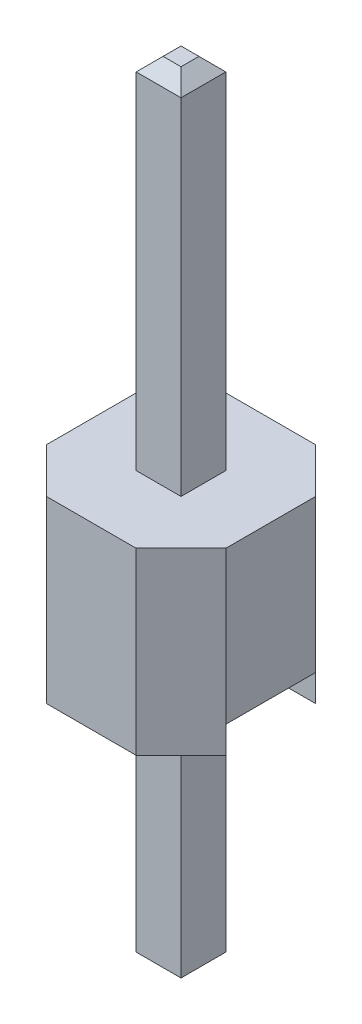
from build123d import *

# Parameters (mm, degrees)
BOSS_EXTRUDE1_DEPTH = 2.54
CUT_EXTRUDE1_REACH  = 5.81
SKETCH2_W           = 1.27
SKETCH2_H           = 0.381
SKETCH3_W           = 0.635
SKETCH3_H           = 0.635
BOSS_EXTRUDE2_DEPTH = 5.08
CHAMFER1_SIZE       = 0.1905
SKETCH4_W           = 0.635
SKETCH4_H           = 0.635
BOSS_EXTRUDE3_DEPTH = 3.937
CHAMFER2_SIZE       = 0.1905


with BuildPart() as part:
    # Sketch1 → Boss-Extrude1 (new body)
    with BuildSketch(Plane(origin=(0, 0, 0), x_dir=(1, 0, 0), z_dir=(0, 1, 0))):
        Polygon((0.635, 1.27), (1.27, 0.635), (1.27, -0.635), (0.635, -1.27), (-0.635, -1.27), (-1.27, -0.635), (-1.27, 0.635), (-0.635, 1.27), align=None)
    extrude(amount=BOSS_EXTRUDE1_DEPTH)

    # Cut-Extrude1: up to this face of the body (flat: up to its plane)
    cut_extrude1_end = Plane(part.part.faces().sort_by_distance((-1.27, 1.27, 0))[0])
    # Sketch2 → Cut-Extrude1 (cut, up to the picked face)
    with BuildSketch(Plane(origin=(1.27, 0, 0), x_dir=(0, 0, -1), z_dir=(1, 0, 0)), mode=Mode.PRIVATE) as cut_extrude1_sk1:
        with Locations((0, 0.1905)):
            Rectangle(SKETCH2_W, SKETCH2_H)
    cut_extrude1_tool1 = split(extrude(cut_extrude1_sk1.sketch, amount=-CUT_EXTRUDE1_REACH, mode=Mode.PRIVATE), bisect_by=cut_extrude1_end, keep=Keep.BOTH, mode=Mode.PRIVATE)
    add(cut_extrude1_tool1.solids().sort_by(Axis((1.27, 0.1905, 0), (-1, 0, 0)))[0], mode=Mode.SUBTRACT)

    # Sketch3 → Boss-Extrude2 (add)
    with BuildSketch(Plane(origin=(0, 2.54, 0), x_dir=(1, 0, 0), z_dir=(0, 1, 0))):
        Rectangle(SKETCH3_W, SKETCH3_H)
    extrude(amount=BOSS_EXTRUDE2_DEPTH)

    # Chamfer1
    chamfer1_edges = [part.edges().sort_by_distance(p)[0] for p in [
        (0.3175, 7.62, 0),
        (0, 7.62, -0.3175),
        (-0.3175, 7.62, 0),
        (0, 7.62, 0.3175),
    ]]
    chamfer(chamfer1_edges, length=CHAMFER1_SIZE)

    # Sketch4 → Boss-Extrude3 (add)
    with BuildSketch(Plane.XZ.offset(-0.381)):
        Rectangle(SKETCH4_W, SKETCH4_H)
    extrude(amount=BOSS_EXTRUDE3_DEPTH)

    # Chamfer2
    chamfer2_edges = [part.edges().sort_by_distance(p)[0] for p in [
        (0.3175, -3.556, 0),
        (0, -3.556, 0.3175),
        (-0.3175, -3.556, 0),
        (0, -3.556, -0.3175),
    ]]
    chamfer(chamfer2_edges, length=CHAMFER2_SIZE)


solid = part.part
